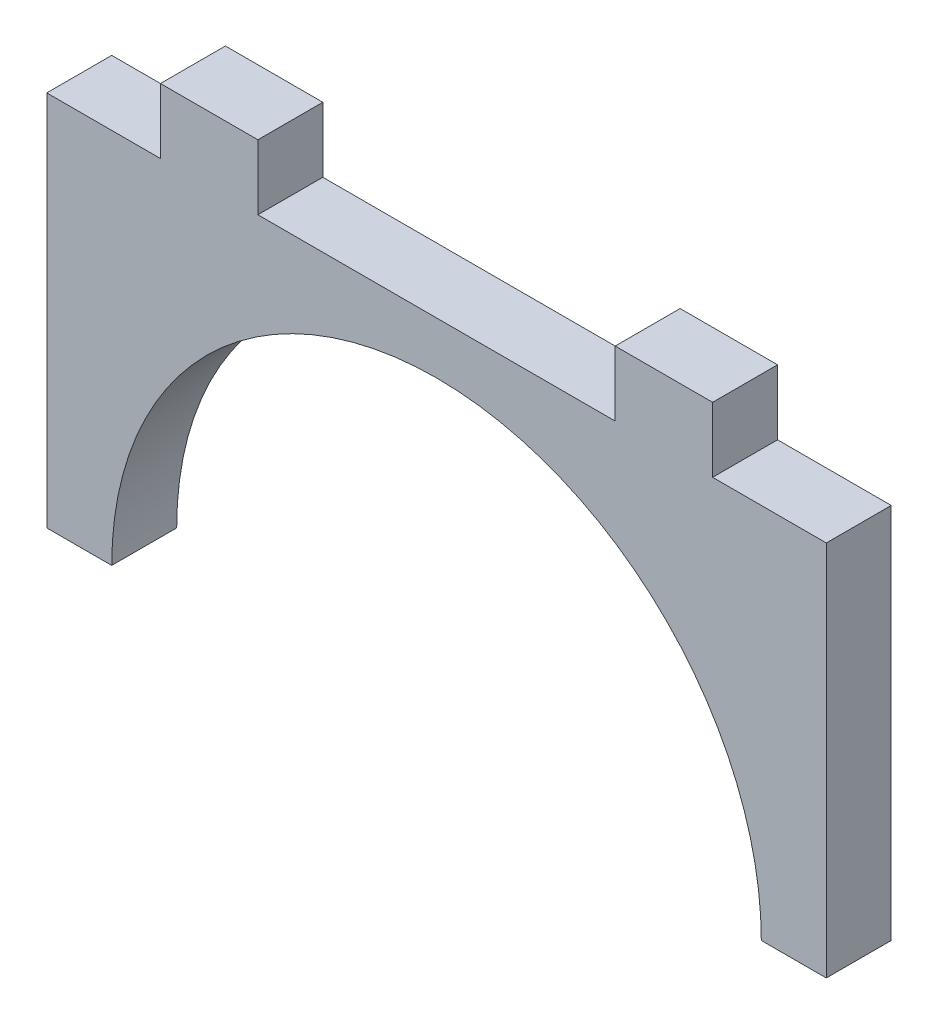
from build123d import *

# Parameters (mm, degrees)
EXTRUDE1_DEPTH = 12.7


with BuildPart() as part:
    # Sketch1 → Extrude1 (new body)
    with BuildSketch(Plane.XY):
        with BuildLine():
            Line((76.2, 142.24), (63.5, 142.24))
            ThreePointArc((63.5, 142.24), (0, 205.74), (-63.5, 142.24))
            Line((-63.5, 142.24), (-76.2, 142.24))
            Line((-76.2, 142.24), (-76.2, 215.9))
            Line((-76.2, 215.9), (-53.975, 215.9))
            Line((-53.975, 215.9), (-53.975, 228.6))
            Line((-53.975, 228.6), (-34.925, 228.6))
            Line((-34.925, 228.6), (-34.925, 215.9))
            Line((-34.925, 215.9), (34.925, 215.9))
            Line((34.925, 215.9), (34.925, 228.6))
            Line((34.925, 228.6), (53.975, 228.6))
            Line((53.975, 228.6), (53.975, 215.9))
            Line((53.975, 215.9), (76.2, 215.9))
            Line((76.2, 215.9), (76.2, 142.24))
        make_face()
    extrude(amount=-EXTRUDE1_DEPTH)


solid = part.part
